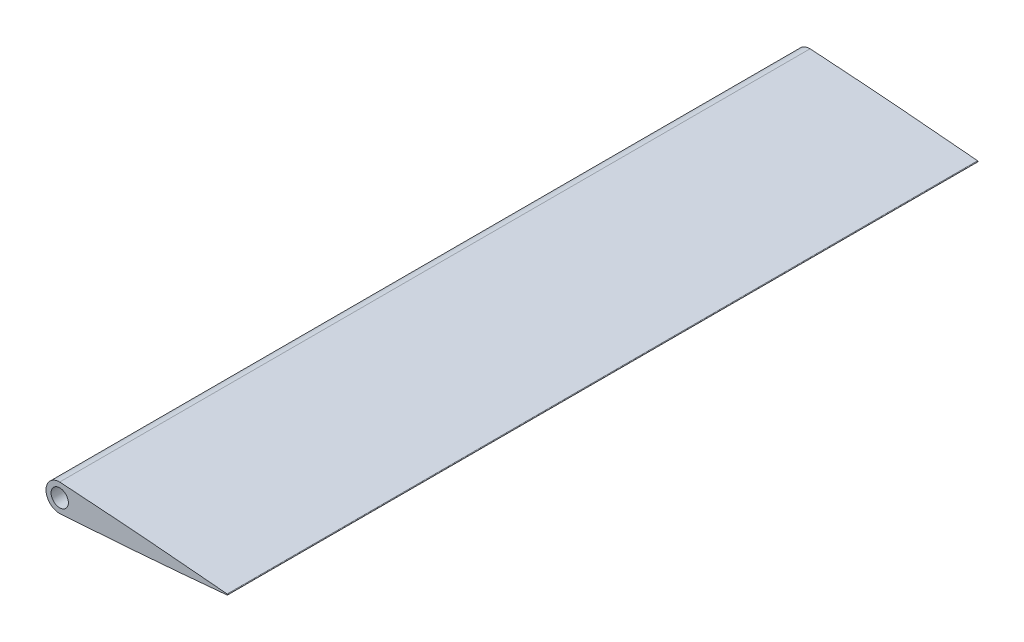
from build123d import *

# Parameters (mm, degrees)
CORPOFOAM_DEPTH = 130
SCHIZZO2_R      = 1.5
FOROPERNO_DEPTH = 165.080651811


with BuildPart() as part:
    # Schizzo1 → CorpoFoam (new body)
    with BuildSketch(Plane.XY):
        with BuildLine():
            ThreePointArc((100, 0.084), (100.084, 0), (100, -0.084))
            add(Edge.make_bspline(
                [(71, -2.377645078), (74.000829106, -2.180171911), (80.336320929, -1.737523123), (88.335559621, -1.11089898), (95.001194725, -0.542172688), (98.333488815, -0.23674648), (100, -0.084)],
                knots=[0.855853291, 0.855853291, 0.855853291, 0.855853291, 0.900556598, 0.950258285, 0.975123707, 1, 1, 1, 1], degree=3))
            ThreePointArc((71, -2.377645078), (68.622354922, 0), (71, 2.377645078))
            add(Edge.make_bspline(
                [(100, 0.084), (98.333488815, 0.23674648), (95.001194725, 0.542172689), (88.335559621, 1.11089898), (80.336320929, 1.737523123), (74.000829106, 2.180171911), (71, 2.377645078)],
                knots=[0, 0, 0, 0, 0.024876293, 0.049741715, 0.099443402, 0.144146709, 0.144146709, 0.144146709, 0.144146709], degree=3))
        make_face()
    extrude(amount=CORPOFOAM_DEPTH)

    # Schizzo2 → ForoPerno (cut, through all)
    with BuildSketch(Plane(origin=(0, 0, 0), x_dir=(-1, 0, 0), z_dir=(0, 0, -1))):
        with Locations((-71, 0)):
            Circle(SCHIZZO2_R)
    extrude(amount=-FOROPERNO_DEPTH, mode=Mode.SUBTRACT)


solid = part.part
